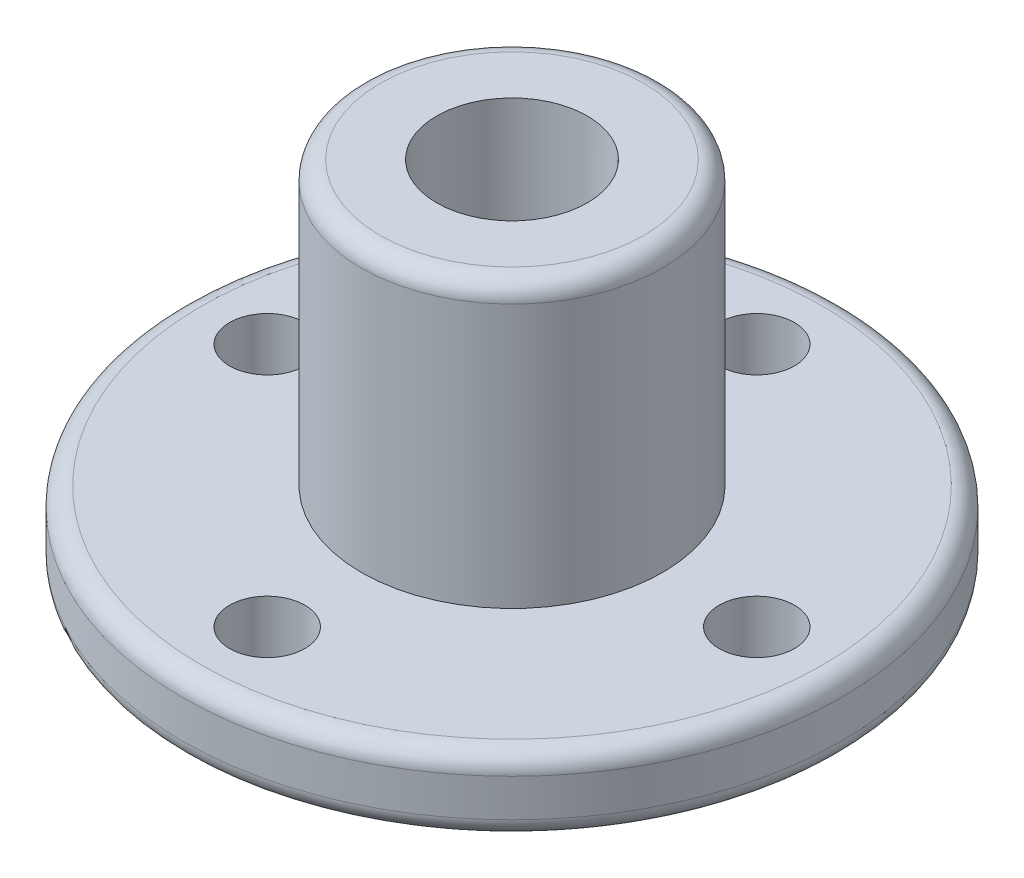
from build123d import *

# Parameters (mm, degrees)
SKETCH_1_R               = 17.5
EXTRUDE_1_DEPTH          = 4
SKETCH_2_R               = 8
SKETCH_2_R_2             = 4
EXTRUDE_2_DEPTH          = 15
CUT_EXTRUDE_1_REACH      = 33.201
CUT_EXTRUDE_1_END_RADIUS = 8
SKETCH_3_R               = 2
FILLET_1_R               = 1
SKETCH_4_R               = 2
CUT_EXTRUDE_2_DEPTH      = 15


with BuildPart() as part:
    # 草图1 → 凸台-拉伸1 (new body)
    with BuildSketch(Plane(origin=(0, 0, 0), x_dir=(1, 0, 0), z_dir=(0, 1, 0))):
        with Locations(Location((0, 0, 0), (0, 0, 270))):
            Circle(SKETCH_1_R)
    extrude(amount=EXTRUDE_1_DEPTH)

    # 草图2 → 凸台-拉伸2 (add)
    with BuildSketch(Plane(origin=(0, 4, 0), x_dir=(1, 0, 0), z_dir=(0, 1, 0))):
        with Locations(Location((0, 0, 0), (0, 0, 270))):
            Circle(SKETCH_2_R)
        with Locations(Location((0, 0, 0), (0, 0, 270))):
            Circle(SKETCH_2_R_2, mode=Mode.SUBTRACT)
    extrude(amount=EXTRUDE_2_DEPTH)

    # 切除-拉伸1: up to this cylinder (the profile starts inside it)
    cut_extrude_1_end = Plane(origin=(0, 12, 0), z_dir=(0, -1, 0)) * Cylinder(CUT_EXTRUDE_1_END_RADIUS, 83.402, mode=Mode.PRIVATE)
    # 草图3 → 切除-拉伸1 (cut, up to the surface)
    with BuildSketch(Plane.XY, mode=Mode.PRIVATE) as cut_extrude_1_sk1:
        with Locations((0, 12)):
            Circle(SKETCH_3_R)
    cut_extrude_1_tool1 = extrude(cut_extrude_1_sk1.sketch, amount=-CUT_EXTRUDE_1_REACH, mode=Mode.PRIVATE) & cut_extrude_1_end
    add(cut_extrude_1_tool1.solids().sort_by_distance((0, 12, 0))[0], mode=Mode.SUBTRACT)

    # 圆角1
    fillet_1_edges = [part.edges().sort_by_distance(p)[0] for p in [
        (0, 0, -17.5),
        (0, 4, -17.5),
        (0, 19, -8),
    ]]
    fillet(fillet_1_edges, radius=FILLET_1_R)

    # 草图4 → 切除-拉伸2 (cut)
    with BuildSketch(Plane(origin=(0, 4, 0), x_dir=(1, 0, 0), z_dir=(0, 1, 0))):
        with Locations(Location((-13, 0, 0), (0, 0, 270))):
            Circle(SKETCH_4_R)
        with Locations(Location((0, -13, 0), (0, 0, 270))):
            Circle(SKETCH_4_R)
        with Locations(Location((0, 13, 0), (0, 0, 270))):
            Circle(SKETCH_4_R)
        with Locations(Location((13, 0, 0), (0, 0, 270))):
            Circle(SKETCH_4_R)
    extrude(amount=-CUT_EXTRUDE_2_DEPTH, mode=Mode.SUBTRACT)


solid = part.part
